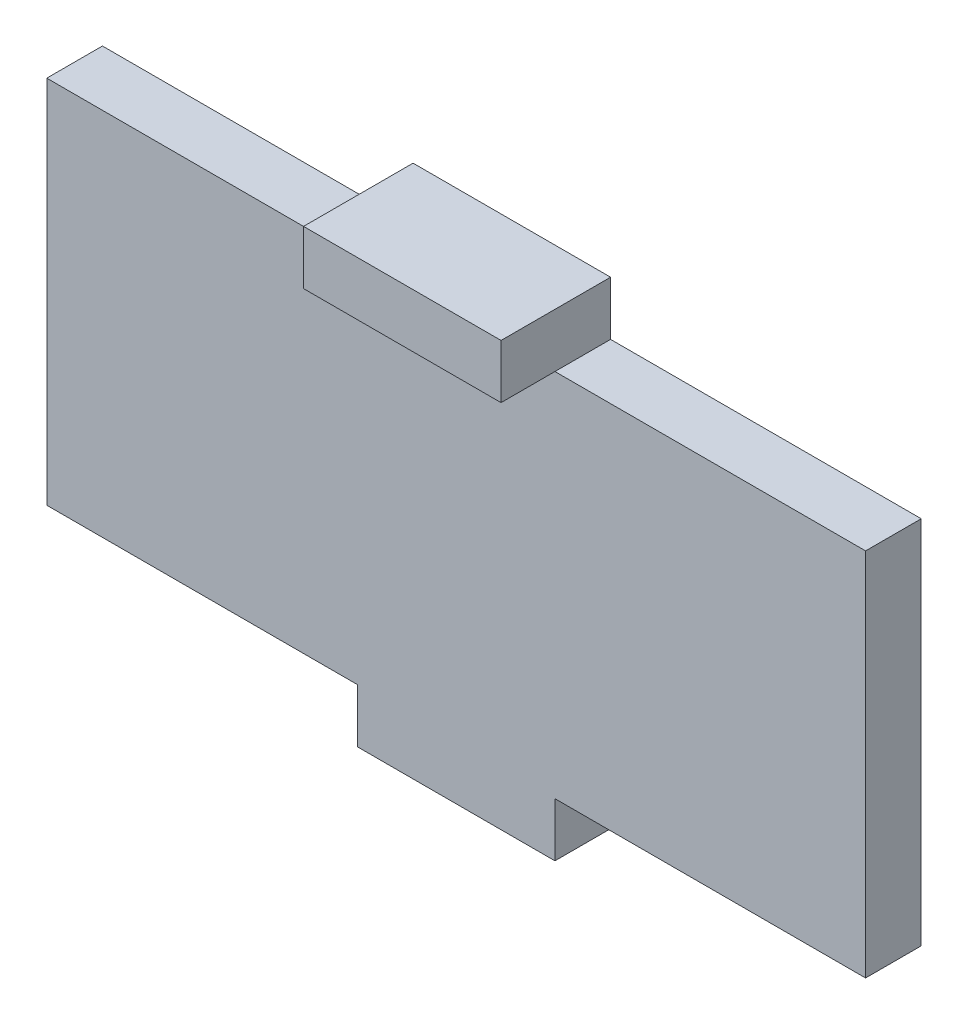
from build123d import *

# Parameters (mm, degrees)
SKETCH1_W           = 17.3
SKETCH1_H           = 20.6
SKETCH1_W_2         = 5.5
SKETCH1_H_2         = 3
BOSS_EXTRUDE1_DEPTH = 1.1
SKETCH2_W           = 11
SKETCH2_H           = 3
BOSS_EXTRUDE2_DEPTH = 3
SKETCH3_W           = 17.3
SKETCH3_H           = 20.6
SKETCH3_W_2         = 11
SKETCH3_H_2         = 3
BOSS_EXTRUDE3_DEPTH = 2


with BuildPart() as part:
    # Sketch1 → Boss-Extrude1 (new body)
    with BuildSketch(Plane.XY):
        with Locations((8.65, 10.3)):
            Rectangle(SKETCH1_W, SKETCH1_H)
        with Locations((20.05, 22.1)):
            Rectangle(SKETCH1_W_2, SKETCH1_H_2)
        with Locations((25.55, 22.1)):
            Rectangle(SKETCH1_W_2, SKETCH1_H_2)
        Polygon((28.3, 20.6), (22.8, 20.6), (17.3, 20.6), (17.3, 0), (22.8, 0), (28.3, 0), align=None)
        with Locations((36.95, 10.3)):
            Rectangle(SKETCH1_W, SKETCH1_H)
        with Locations((25.55, -1.5)):
            Rectangle(SKETCH1_W_2, SKETCH1_H_2)
        with Locations((20.05, -1.5)):
            Rectangle(SKETCH1_W_2, SKETCH1_H_2)
    extrude(amount=BOSS_EXTRUDE1_DEPTH)

    # Sketch2 → Boss-Extrude2 (add)
    with BuildSketch(Plane.XY.offset(1.1)):
        with Locations((22.8, 22.1)):
            Rectangle(SKETCH2_W, SKETCH2_H)
    extrude(amount=BOSS_EXTRUDE2_DEPTH)

    # Sketch3 → Boss-Extrude3 (add)
    with BuildSketch(Plane(origin=(0, 0, 0), x_dir=(-1, 0, 0), z_dir=(0, 0, -1))):
        with Locations((-36.95, 10.3)):
            Rectangle(SKETCH3_W, SKETCH3_H)
        with Locations((-22.8, 22.1)):
            Rectangle(SKETCH3_W_2, SKETCH3_H_2)
        with Locations((-22.8, 10.3)):
            Rectangle(SKETCH3_W_2, SKETCH3_H)
        with Locations((-8.65, 10.3)):
            Rectangle(SKETCH3_W, SKETCH3_H)
        with Locations((-22.8, -1.5)):
            Rectangle(SKETCH3_W_2, SKETCH3_H_2)
    extrude(amount=BOSS_EXTRUDE3_DEPTH)


solid = part.part
